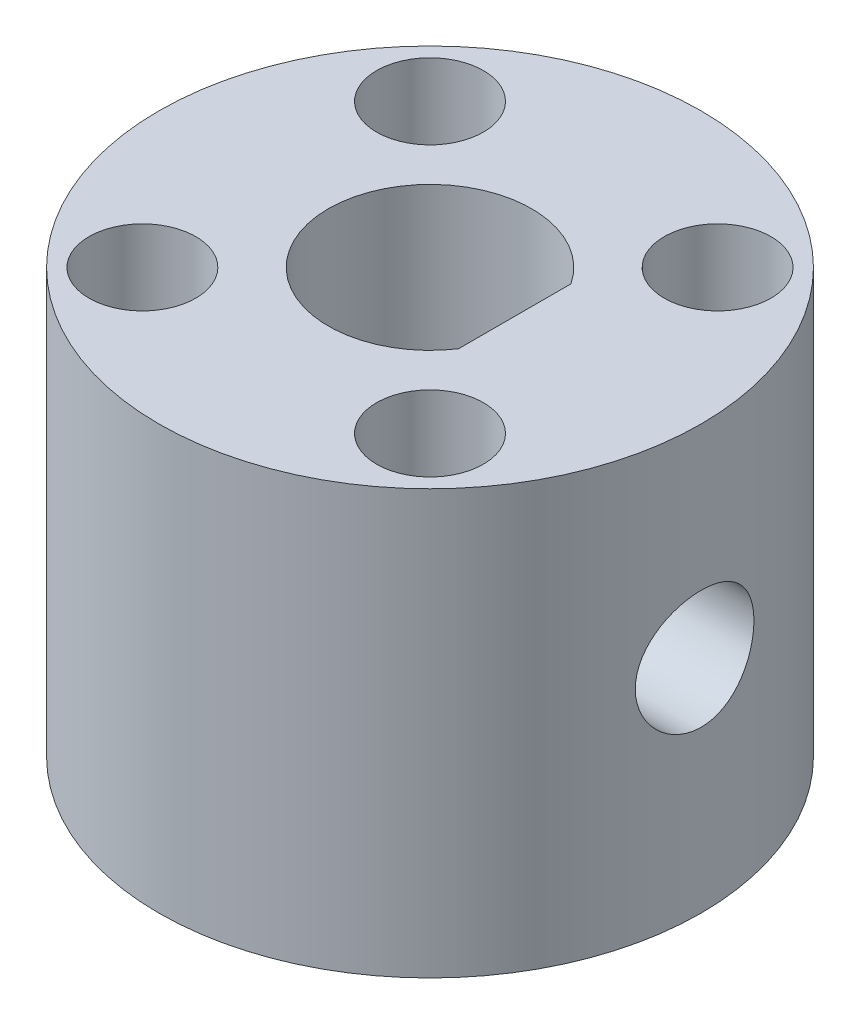
from build123d import *

# Parameters (mm, degrees)
SKETCH_1_R          = 8
SKETCH_1_R_2        = 1.575
EXTRUDE_1_DEPTH     = 12.5
SKETCH_3_R          = 1.75
CUT_EXTRUDE_1_DEPTH = 10


with BuildPart() as part:
    # 草图1 → 凸台-拉伸1 (new body)
    with BuildSketch(Plane(origin=(0, 0, 0), x_dir=(1, 0, 0), z_dir=(0, 1, 0))):
        with Locations(Location((0, 0, 0), (0, 0, 270))):
            Circle(SKETCH_1_R)
        with Locations(Location((4.242640687, 4.242640687, 0), (0, 0, 270))):
            Circle(SKETCH_1_R_2, mode=Mode.SUBTRACT)
        with Locations(Location((4.242640687, -4.242640687, 0), (0, 0, 270))):
            Circle(SKETCH_1_R_2, mode=Mode.SUBTRACT)
        with Locations(Location((-4.242640687, -4.242640687, 0), (0, 0, 270))):
            Circle(SKETCH_1_R_2, mode=Mode.SUBTRACT)
        with Locations(Location((-4.242640687, 4.242640687, 0), (0, 0, 270))):
            Circle(SKETCH_1_R_2, mode=Mode.SUBTRACT)
        with BuildLine():
            Line((2.5, 1.658312395), (2.5, -1.658312395))
            ThreePointArc((2.5, -1.658312395), (-3, 0), (2.5, 1.658312395))
        make_face(mode=Mode.SUBTRACT)
    extrude(amount=EXTRUDE_1_DEPTH)

    # 草图3 → 切除-拉伸1 (cut)
    with BuildSketch(Plane.ZY.offset(-2.5)):
        with Locations((0, 6.5)):
            Circle(SKETCH_3_R)
    extrude(amount=-CUT_EXTRUDE_1_DEPTH, mode=Mode.SUBTRACT)


solid = part.part
